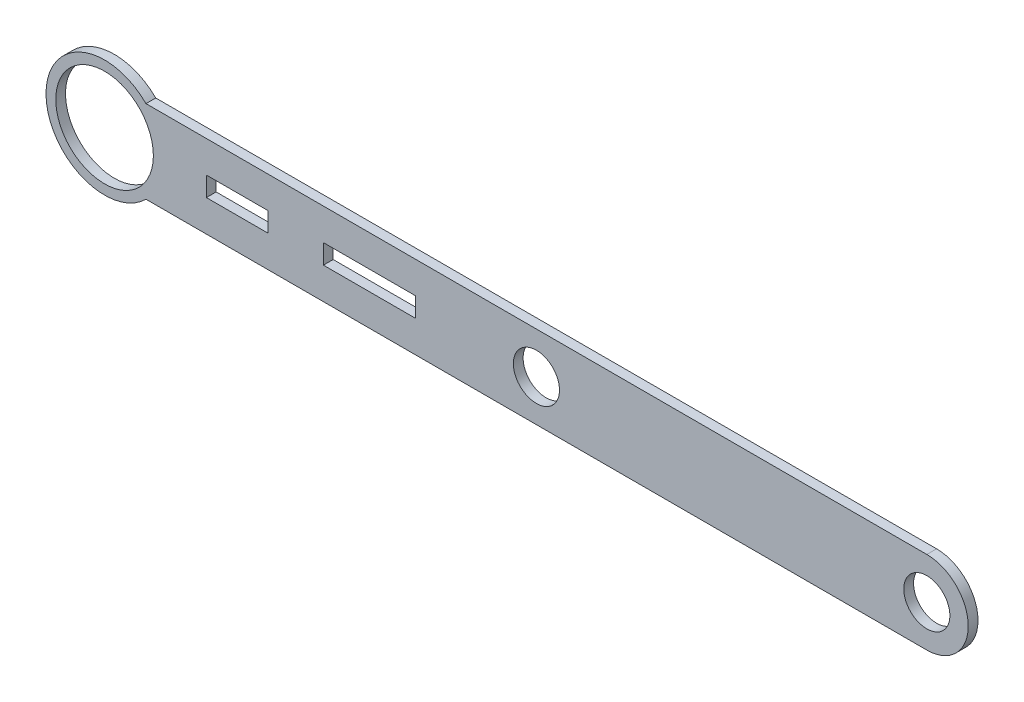
from build123d import *

# Parameters (mm, degrees)
SKETCH1_R           = 15.875
SKETCH1_R_2         = 7.5
SKETCH1_W           = 20
SKETCH1_H           = 6.35
SKETCH1_W_2         = 30
BOSS_EXTRUDE1_DEPTH = 3.175


with BuildPart() as part:
    # Sketch1 → Boss-Extrude1 (new body)
    with BuildSketch(Plane.XY):
        with BuildLine():
            Line((13.470384182, 13.470384182), (267.470384182, 13.470384182))
            ThreePointArc((267.470384182, 13.470384182), (280.940768363, 0), (267.470384182, -13.470384182))
            Line((267.470384182, -13.470384182), (13.470384182, -13.470384182))
            ThreePointArc((13.470384182, -13.470384182), (-19.05, 0), (13.470384182, 13.470384182))
        make_face()
        Circle(SKETCH1_R, mode=Mode.SUBTRACT)
        with Locations((267.470384182, 0)):
            Circle(SKETCH1_R_2, mode=Mode.SUBTRACT)
        with Locations((140.470384182, 0)):
            Circle(SKETCH1_R_2, mode=Mode.SUBTRACT)
        with Locations((43.11714777, 0)):
            Rectangle(SKETCH1_W, SKETCH1_H, mode=Mode.SUBTRACT)
        with Locations((86.195594821, 0)):
            Rectangle(SKETCH1_W_2, SKETCH1_H, mode=Mode.SUBTRACT)
    extrude(amount=BOSS_EXTRUDE1_DEPTH)


solid = part.part
